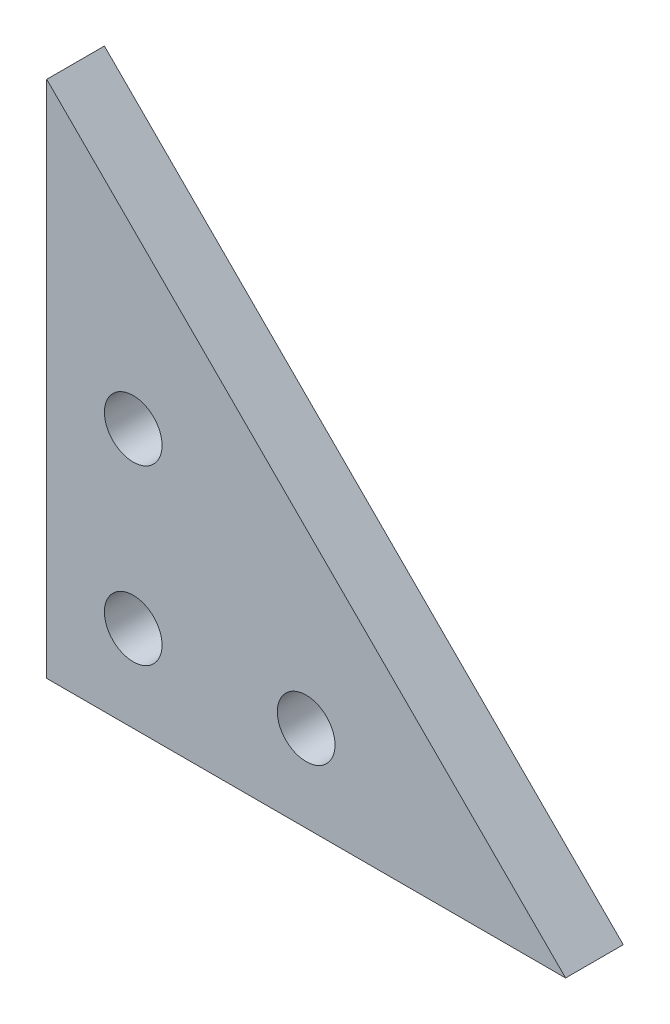
from build123d import *

# Parameters (mm, degrees)
MODEL_R                 = 1.5
SALIENTE_EXTRUIR1_DEPTH = 3


with BuildPart() as part:
    # Model → Saliente-Extruir1 (new body)
    with BuildSketch(Plane.XY):
        Polygon((-105.943383637, 105.556539338), (-105.943383637, 78.556539338), (-78.943383637, 78.556539338), align=None)
        with Locations((-101.443383637, 92.056539338)):
            Circle(MODEL_R, mode=Mode.SUBTRACT)
        with Locations((-101.443383637, 83.056539338)):
            Circle(MODEL_R, mode=Mode.SUBTRACT)
        with Locations((-92.443383637, 83.056539338)):
            Circle(MODEL_R, mode=Mode.SUBTRACT)
    extrude(amount=SALIENTE_EXTRUIR1_DEPTH)


solid = part.part
